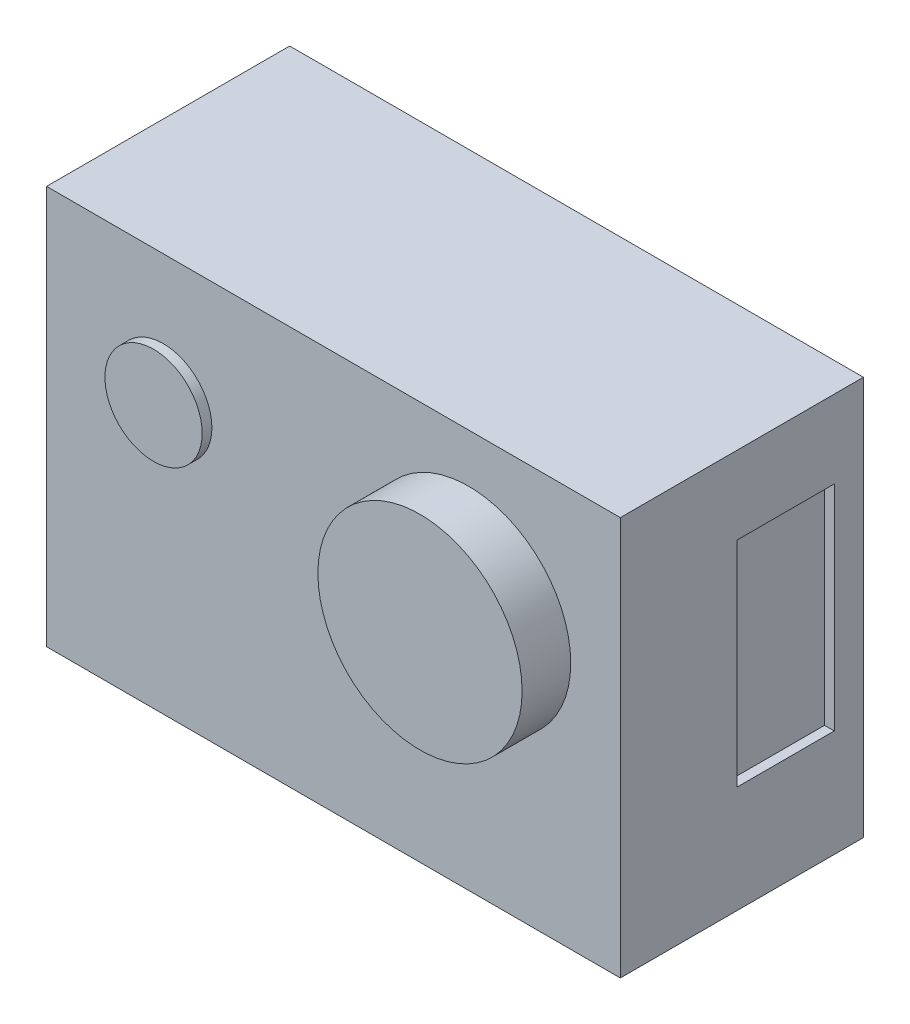
from build123d import *

# Parameters (mm, degrees)
SKETCH_1_W          = 59
SKETCH_1_H          = 41
EXTRUDE_1_DEPTH     = 25
SKETCH_2_R          = 10.5
EXTRUDE_2_DEPTH     = 5
SKETCH_5_R          = 5
EXTRUDE_3_DEPTH     = 1
SKETCH_6_W          = 10
SKETCH_6_H          = 22
CUT_EXTRUDE_1_DEPTH = 1


with BuildPart() as part:
    # Эскиз1 → Бобышка-Вытянуть1 (new body)
    with BuildSketch(Plane.XY):
        Rectangle(SKETCH_1_W, SKETCH_1_H)
    extrude(amount=EXTRUDE_1_DEPTH)

    # Эскиз2 → Бобышка-Вытянуть2 (add)
    with BuildSketch(Plane.XY.offset(25)):
        with Locations((13.9, 5)):
            Circle(SKETCH_2_R)
    extrude(amount=EXTRUDE_2_DEPTH)

    # Эскиз5 → Бобышка-Вытянуть3 (add)
    with BuildSketch(Plane.XY.offset(25)):
        with Locations((-17.5, 7.5)):
            Circle(SKETCH_5_R)
    extrude(amount=EXTRUDE_3_DEPTH)

    # Эскиз6 → Вырез-Вытянуть1 (cut)
    with BuildSketch(Plane(origin=(29.5, 0, 0), x_dir=(0, 0, -1), z_dir=(1, 0, 0))):
        with Locations((-8, 1.5)):
            Rectangle(SKETCH_6_W, SKETCH_6_H)
    extrude(amount=-CUT_EXTRUDE_1_DEPTH, mode=Mode.SUBTRACT)


solid = part.part
